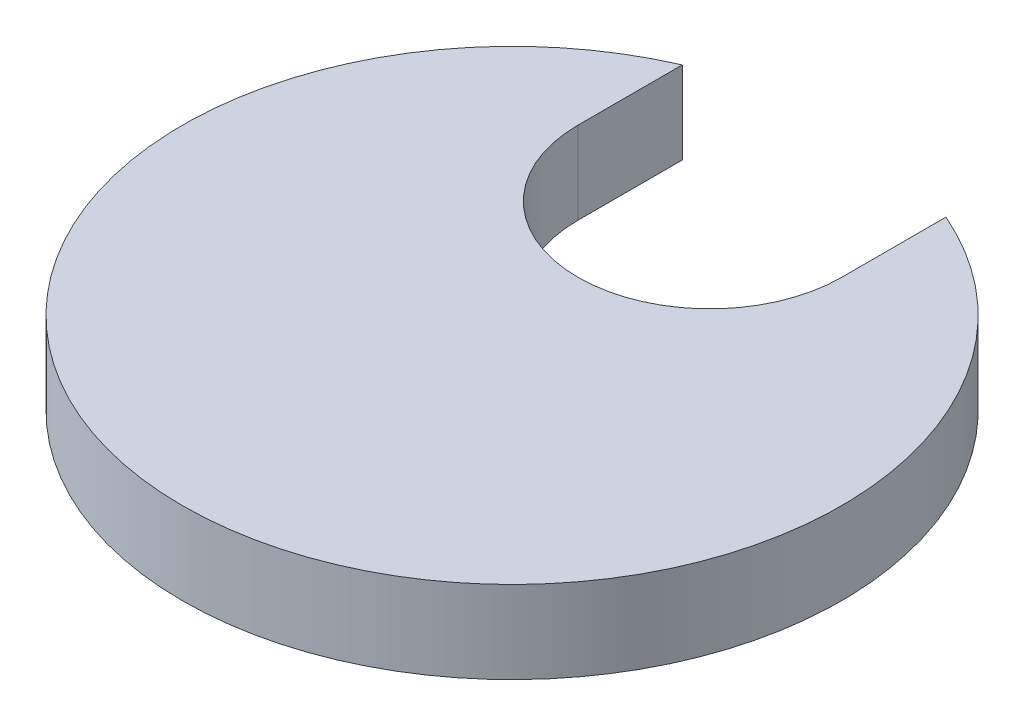
from build123d import *

# Parameters (mm, degrees)
BOSS_EXTRUDE1_DEPTH = 2.5


with BuildPart() as part:
    # Sketch1 → Boss-Extrude1 (new body)
    with BuildSketch(Plane(origin=(0, 0, 0), x_dir=(1, 0, 0), z_dir=(0, 1, 0))):
        with BuildLine():
            ThreePointArc((4, 6), (0, 2), (-4, 6))
            Line((-4, 6), (-4, 9.16515139))
            ThreePointArc((-4, 9.16515139), (-5.477225575, -8.366600265), (10, 0))
            ThreePointArc((10, 0), (8.366600265, 5.477225575), (4, 9.16515139))
            Line((4, 9.16515139), (4, 6))
        make_face()
    extrude(amount=BOSS_EXTRUDE1_DEPTH)


solid = part.part
